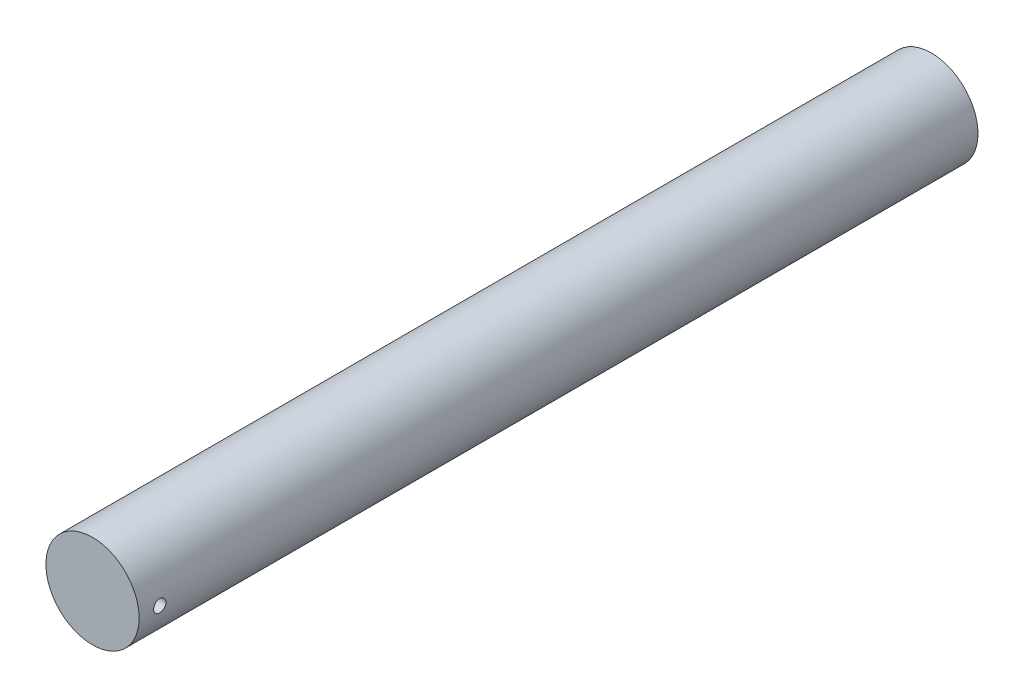
from build123d import *

# Parameters (mm, degrees)
SKETCH1_R           = 3.81
BOSS_EXTRUDE1_DEPTH = 34.29
SCALE1_SCALE        = 1.5
SKETCH2_R           = 0.762
CUT_EXTRUDE1_DEPTH  = 53.066127905
SKETCH3_R           = 1.397
CUT_EXTRUDE2_DEPTH  = 53.066128026


with BuildPart() as part:
    # Sketch1 → Boss-Extrude1 (new, symmetric)
    with BuildSketch(Plane.XY):
        Circle(SKETCH1_R)
    extrude(amount=BOSS_EXTRUDE1_DEPTH, both=True)


with BuildPart() as part_1:
    # Scale1: scaled about (0, 0, 0)
    add(part.part.scale(SCALE1_SCALE))

    # Sketch2 → Cut-Extrude1 (cut, through all)
    with BuildSketch(Plane(origin=(0, 0, 0), x_dir=(0, 0, -1), z_dir=(1, 0, 0))):
        with Locations((-48.895, 0)):
            Circle(SKETCH2_R)
    extrude(amount=CUT_EXTRUDE1_DEPTH, mode=Mode.SUBTRACT)

    # Sketch3 → Cut-Extrude2 (cut, through all)
    with BuildSketch(Plane(origin=(0, 0, 0), x_dir=(-0.7071067811865476, 0.7071067811865476, 0), z_dir=(0.7071067811865476, 0.7071067811865476, 0))):
        with Locations((0, -5.715)):
            Circle(SKETCH3_R)
    extrude(amount=-CUT_EXTRUDE2_DEPTH, mode=Mode.SUBTRACT)


solid = part_1.part
